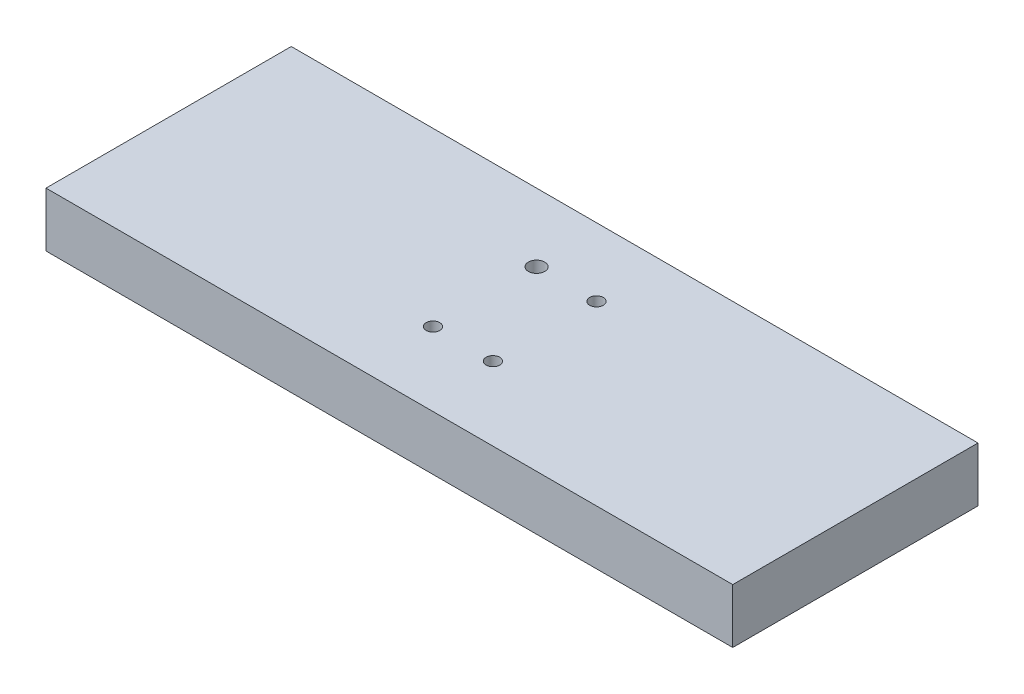
from build123d import *

# Parameters (mm, degrees)
SCHIZZO1_W                   = 252
SCHIZZO1_H                   = 90
ESTRUSIONE_ESTRUSIONE1_DEPTH = 20
SCHIZZO3_R                   = 2.999999993
SCHIZZO3_R_2                 = 2.499999993
TAGLIO_ESTRUSIONE1_DEPTH     = 20


with BuildPart() as part:
    # Schizzo1 → Estrusione-Estrusione1 (new body)
    with BuildSketch(Plane(origin=(0, 0, 0), x_dir=(1, 0, 0), z_dir=(0, 1, 0))):
        Rectangle(SCHIZZO1_W, SCHIZZO1_H)
    extrude(amount=ESTRUSIONE_ESTRUSIONE1_DEPTH)

    # Schizzo3 → Taglio-Estrusione1 (cut)
    with BuildSketch(Plane(origin=(0, 20, 0), x_dir=(1, 0, 0), z_dir=(0, 1, 0))):
        with Locations(Location((-10.999999992, 20, 0), (0, 0, 270))):
            Circle(SCHIZZO3_R)
        with Locations(Location((11.000000008, 20, 0), (0, 0, 270))):
            Circle(SCHIZZO3_R_2)
        with Locations(Location((11.000000008, -18, 0), (0, 0, 270))):
            Circle(SCHIZZO3_R_2)
        with Locations(Location((-10.999999992, -18, 0), (0, 0, 270))):
            Circle(SCHIZZO3_R_2)
    extrude(amount=-TAGLIO_ESTRUSIONE1_DEPTH, mode=Mode.SUBTRACT)


solid = part.part
